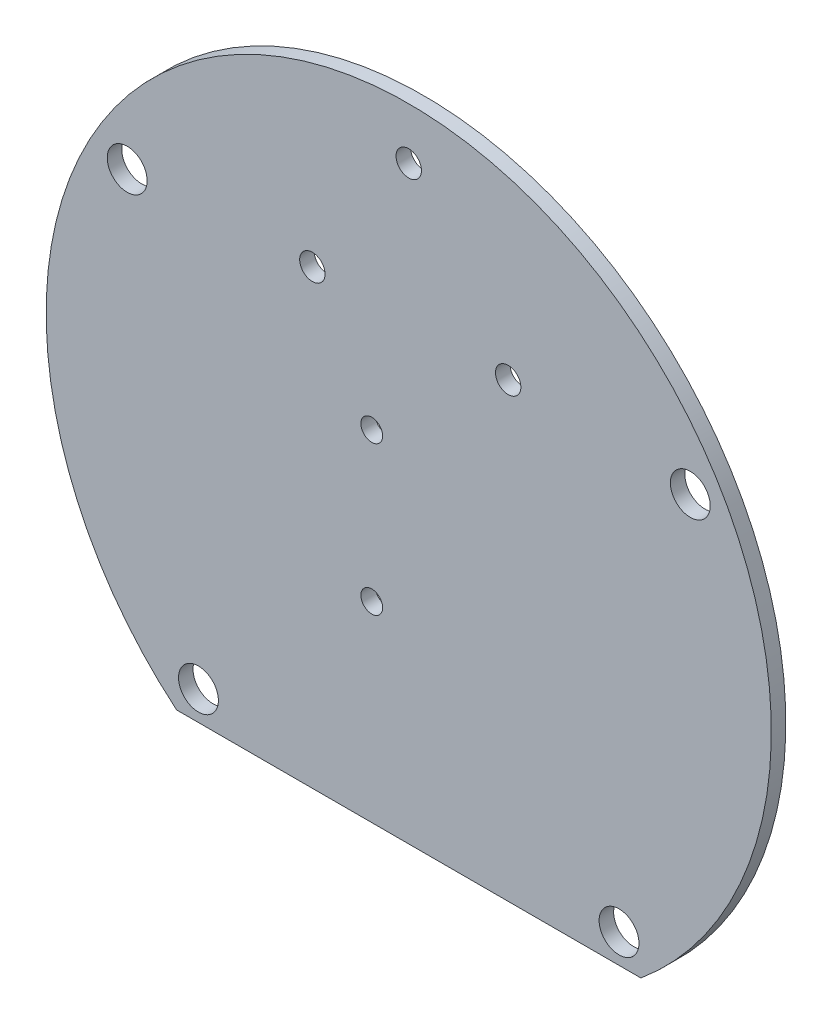
from build123d import *

# Parameters (mm, degrees)
ESBO_O1_R                  = 50
RESSALTO_EXTRUS_O1_DEPTH   = 2
ESBO_O2_R                  = 2.75
CORTE_EXTRUS_O1_DEPTH      = 2
CORTE_EXTRUS_O2_DEPTH      = 71.738956735
CORTE_EXTRUS_O2_DEPTH_BACK = 10
ESBO_O5_R                  = 1.5
ESBO_O5_R_2                = 1.75
CORTE_EXTRUS_O3_DEPTH      = 10


with BuildPart() as part:
    # Esboço1 → Ressalto-extrusão1 (new body)
    with BuildSketch(Plane.XY):
        Circle(ESBO_O1_R)
    extrude(amount=RESSALTO_EXTRUS_O1_DEPTH)

    # Esboço2 → Corte-extrusão1 (cut)
    with BuildSketch(Plane.XY.offset(2)):
        with Locations((-29, -34.409301068)):
            Circle(ESBO_O2_R)
        with Locations((29, -34.409301068)):
            Circle(ESBO_O2_R)
        with Locations((-38.824197531, 22.752619324)):
            Circle(ESBO_O2_R)
        with Locations((38.824197531, 22.752619324)):
            Circle(ESBO_O2_R)
    extrude(amount=-CORTE_EXTRUS_O1_DEPTH, mode=Mode.SUBTRACT)

    # Esboço4 → Corte-extrusão2 (cut, two sides: drawn at the far end of the back side and taken through both)
    with BuildSketch(Plane.XY.offset(2).offset(-CORTE_EXTRUS_O2_DEPTH_BACK)):
        Polygon((-40.723859979, -38.409301068), (44.57073926, -38.409301068), (1.923439641, -68.002213614), align=None)
    extrude(amount=CORTE_EXTRUS_O2_DEPTH + CORTE_EXTRUS_O2_DEPTH_BACK, mode=Mode.SUBTRACT)

    # Esboço5 → Corte-extrusão3 (cut)
    with BuildSketch(Plane(origin=(0, 0, 0), x_dir=(-1, 0, 0), z_dir=(0, 0, -1))):
        with Locations((5.1, 8.5)):
            Circle(ESBO_O5_R)
        with Locations((5.1, -12)):
            Circle(ESBO_O5_R)
        with Locations((-13.71, 23.86)):
            Circle(ESBO_O5_R_2)
        with Locations((13.29, 23.86)):
            Circle(ESBO_O5_R_2)
        with Locations((0, 42.87)):
            Circle(ESBO_O5_R_2)
    extrude(amount=-CORTE_EXTRUS_O3_DEPTH, mode=Mode.SUBTRACT)


solid = part.part
